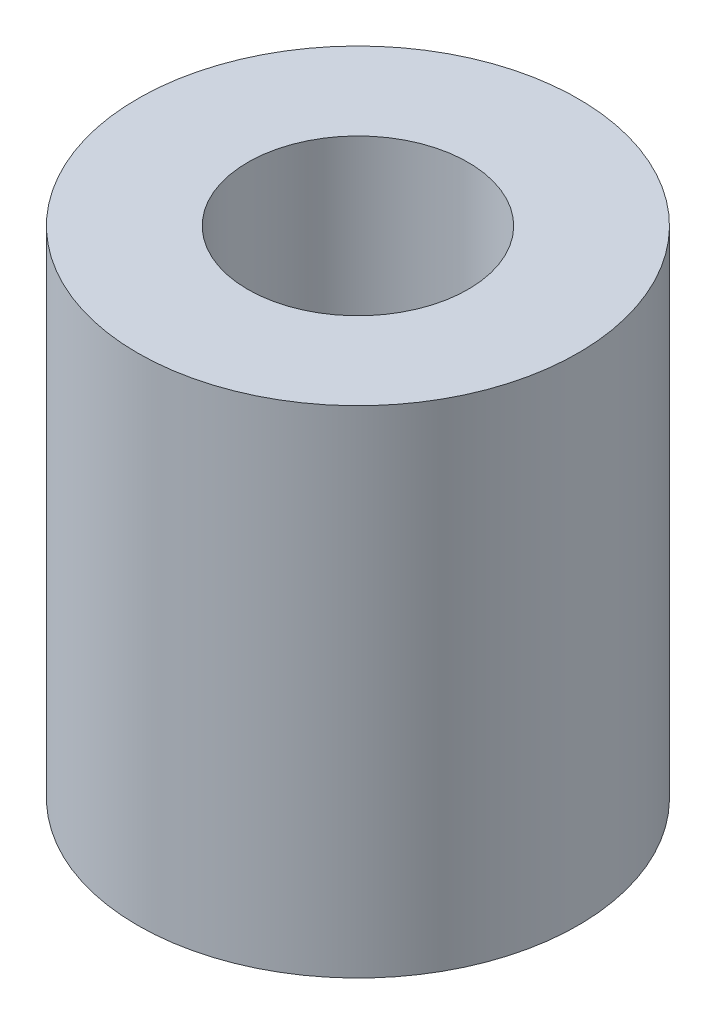
from build123d import *

# Parameters (mm, degrees)
SKETCH1_R           = 6.35
BOSS_EXTRUDE1_DEPTH = 14.2875
SKETCH2_R           = 3.175
CUT_EXTRUDE1_DEPTH  = 17.4625


with BuildPart() as part:
    # Sketch1 → Boss-Extrude1 (new body)
    with BuildSketch(Plane(origin=(0, 0, 0), x_dir=(1, 0, 0), z_dir=(0, 1, 0))):
        with Locations(Location((0, 0, 0), (0, 0, 270))):
            Circle(SKETCH1_R)
    extrude(amount=BOSS_EXTRUDE1_DEPTH)

    # Sketch2 → Cut-Extrude1 (cut)
    with BuildSketch(Plane(origin=(0, 14.2875, 0), x_dir=(1, 0, 0), z_dir=(0, 1, 0))):
        with Locations(Location((0, 0, 0), (0, 0, 270))):
            Circle(SKETCH2_R)
    extrude(amount=-CUT_EXTRUDE1_DEPTH, mode=Mode.SUBTRACT)


solid = part.part
